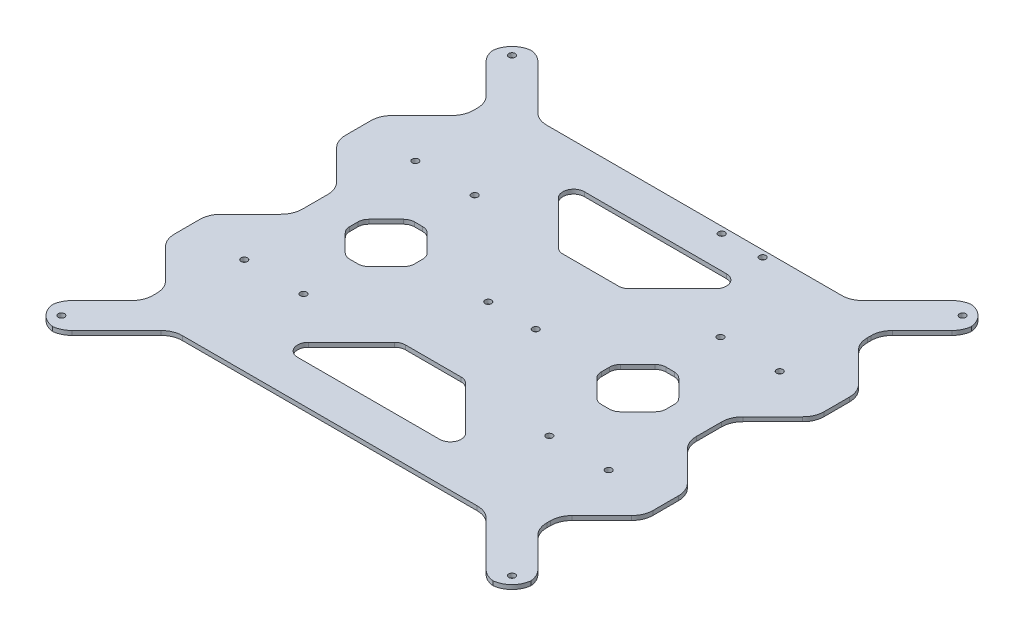
from build123d import *

# Parameters (mm, degrees)
SKETCH1_R           = 1.5
BOSS_EXTRUDE1_DEPTH = 2


with BuildPart() as part:
    # Sketch1 → Boss-Extrude1 (new body)
    with BuildSketch(Plane(origin=(0, 0, 0), x_dir=(1, 0, 0), z_dir=(0, 1, 0))):
        with BuildLine():
            ThreePointArc((-102.071067812, 110.942475232), (-108.071067812, 108.071067812), (-110.942475232, 102.071067812))
            ThreePointArc((-110.942475232, 102.071067812), (-110.02026395, 98.825326817), (-108.071067812, 96.071067812))
            Line((-108.071067812, 96.071067812), (-94.262265521, 82.262265521))
            ThreePointArc((-94.262265521, 82.262265521), (-92.094538008, 79.018032033), (-91.333333333, 75.19119771))
            Line((-91.333333333, 75.19119771), (-91.333333333, 73.475468957))
            ThreePointArc((-91.333333333, 73.475468957), (-92.094538008, 69.648634633), (-94.262265521, 66.404401145))
            Line((-94.262265521, 66.404401145), (-108.071067812, 52.595598855))
            ThreePointArc((-108.071067812, 52.595598855), (-110.238795325, 49.351365367), (-111, 45.524531043))
            Line((-111, 45.524531043), (-111, 33.80880229))
            ThreePointArc((-111, 33.80880229), (-110.238795325, 29.981967967), (-108.071067812, 26.737734479))
            Line((-108.071067812, 26.737734479), (-94.262265521, 12.928932188))
            ThreePointArc((-94.262265521, 12.928932188), (-92.094538008, 9.6846987), (-91.333333333, 5.857864376))
            Line((-91.333333333, 5.857864376), (-91.333333333, -5.857864376))
            ThreePointArc((-91.333333333, -5.857864376), (-92.094538008, -9.6846987), (-94.262265521, -12.928932188))
            Line((-94.262265521, -12.928932188), (-108.071067812, -26.737734479))
            ThreePointArc((-108.071067812, -26.737734479), (-110.238795325, -29.981967967), (-111, -33.80880229))
            Line((-111, -33.80880229), (-111, -45.524531043))
            ThreePointArc((-111, -45.524531043), (-110.238795325, -49.351365367), (-108.071067812, -52.595598855))
            Line((-108.071067812, -52.595598855), (-94.262265521, -66.404401145))
            ThreePointArc((-94.262265521, -66.404401145), (-92.094538008, -69.648634633), (-91.333333333, -73.475468957))
            Line((-91.333333333, -73.475468957), (-91.333333333, -75.19119771))
            ThreePointArc((-91.333333333, -75.19119771), (-92.094538008, -79.018032033), (-94.262265521, -82.262265521))
            Line((-94.262265521, -82.262265521), (-108.071067812, -96.071067812))
            ThreePointArc((-108.071067812, -96.071067812), (-110.02026395, -98.825326817), (-110.942475232, -102.071067812))
            ThreePointArc((-110.942475232, -102.071067812), (-108.071067812, -108.071067812), (-102.071067812, -110.942475232))
            ThreePointArc((-102.071067812, -110.942475232), (-98.825326817, -110.02026395), (-96.071067812, -108.071067812))
            Line((-96.071067812, -108.071067812), (-75.428932188, -87.428932188))
            ThreePointArc((-75.428932188, -87.428932188), (-72.1846987, -85.261204675), (-68.357864376, -84.5))
            Line((-68.357864376, -84.5), (68.357864376, -84.5))
            ThreePointArc((68.357864376, -84.5), (72.1846987, -85.261204675), (75.428932188, -87.428932188))
            Line((75.428932188, -87.428932188), (96.071067812, -108.071067812))
            ThreePointArc((96.071067812, -108.071067812), (98.825326817, -110.02026395), (102.071067812, -110.942475232))
            ThreePointArc((102.071067812, -110.942475232), (108.071067812, -108.071067812), (110.942475232, -102.071067812))
            ThreePointArc((110.942475232, -102.071067812), (110.02026395, -98.825326817), (108.071067812, -96.071067812))
            Line((108.071067812, -96.071067812), (94.262265521, -82.262265521))
            ThreePointArc((94.262265521, -82.262265521), (92.094538008, -79.018032033), (91.333333333, -75.19119771))
            Line((91.333333333, -75.19119771), (91.333333333, -73.475468957))
            ThreePointArc((91.333333333, -73.475468957), (92.094538008, -69.648634633), (94.262265521, -66.404401145))
            Line((94.262265521, -66.404401145), (108.071067812, -52.595598855))
            ThreePointArc((108.071067812, -52.595598855), (110.238795325, -49.351365367), (111, -45.524531043))
            Line((111, -45.524531043), (111, -33.80880229))
            ThreePointArc((111, -33.80880229), (110.238795325, -29.981967967), (108.071067812, -26.737734479))
            Line((108.071067812, -26.737734479), (94.262265521, -12.928932188))
            ThreePointArc((94.262265521, -12.928932188), (92.094538008, -9.6846987), (91.333333333, -5.857864376))
            Line((91.333333333, -5.857864376), (91.333333333, 5.857864376))
            ThreePointArc((91.333333333, 5.857864376), (92.094538008, 9.6846987), (94.262265521, 12.928932188))
            Line((94.262265521, 12.928932188), (108.071067812, 26.737734479))
            ThreePointArc((108.071067812, 26.737734479), (110.238795325, 29.981967967), (111, 33.80880229))
            Line((111, 33.80880229), (111, 45.524531043))
            ThreePointArc((111, 45.524531043), (110.238795325, 49.351365367), (108.071067812, 52.595598855))
            Line((108.071067812, 52.595598855), (94.262265521, 66.404401145))
            ThreePointArc((94.262265521, 66.404401145), (92.094538008, 69.648634633), (91.333333333, 73.475468957))
            Line((91.333333333, 73.475468957), (91.333333333, 75.19119771))
            ThreePointArc((91.333333333, 75.19119771), (92.094538008, 79.018032033), (94.262265521, 82.262265521))
            Line((94.262265521, 82.262265521), (108.071067812, 96.071067812))
            ThreePointArc((108.071067812, 96.071067812), (110.02026395, 98.825326817), (110.942475232, 102.071067812))
            ThreePointArc((110.942475232, 102.071067812), (108.071067812, 108.071067812), (102.071067812, 110.942475232))
            ThreePointArc((102.071067812, 110.942475232), (98.825326817, 110.02026395), (96.071067812, 108.071067812))
            Line((96.071067812, 108.071067812), (75.428932188, 87.428932188))
            ThreePointArc((75.428932188, 87.428932188), (72.1846987, 85.261204675), (68.357864376, 84.5))
            Line((68.357864376, 84.5), (-68.357864376, 84.5))
            ThreePointArc((-68.357864376, 84.5), (-72.1846987, 85.261204675), (-75.428932188, 87.428932188))
            Line((-75.428932188, 87.428932188), (-96.071067812, 108.071067812))
            ThreePointArc((-96.071067812, 108.071067812), (-98.825326817, 110.02026395), (-102.071067812, 110.942475232))
        make_face()
        with Locations(Location((-104.5, -104.5, 0), (0, 0, 270))):
            Circle(SKETCH1_R, mode=Mode.SUBTRACT)
        with Locations(Location((-84.5, -39.666666667, 0), (0, 0, 270))):
            Circle(SKETCH1_R, mode=Mode.SUBTRACT)
        with Locations(Location((-57, -39.666666667, 0), (0, 0, 270))):
            Circle(SKETCH1_R, mode=Mode.SUBTRACT)
        with BuildLine():
            ThreePointArc((-63.797799427, 13.535533906), (-62.175682683, 14.619397663), (-60.262265521, 15))
            Line((-60.262265521, 15), (-56.404401145, 15))
            ThreePointArc((-56.404401145, 15), (-54.490983983, 14.619397663), (-52.868867239, 13.535533906))
            Line((-52.868867239, 13.535533906), (-44.797799427, 5.464466094))
            ThreePointArc((-44.797799427, 5.464466094), (-43.713935671, 3.84234935), (-43.333333333, 1.928932188))
            Line((-43.333333333, 1.928932188), (-43.333333333, -1.928932188))
            ThreePointArc((-43.333333333, -1.928932188), (-43.713935671, -3.84234935), (-44.797799427, -5.464466094))
            Line((-44.797799427, -5.464466094), (-52.868867239, -13.535533906))
            ThreePointArc((-52.868867239, -13.535533906), (-54.490983983, -14.619397663), (-56.404401145, -15))
            Line((-56.404401145, -15), (-60.262265521, -15))
            ThreePointArc((-60.262265521, -15), (-62.175682683, -14.619397663), (-63.797799427, -13.535533906))
            Line((-63.797799427, -13.535533906), (-71.868867239, -5.464466094))
            ThreePointArc((-71.868867239, -5.464466094), (-72.952730996, -3.84234935), (-73.333333333, -1.928932188))
            Line((-73.333333333, -1.928932188), (-73.333333333, 1.928932188))
            ThreePointArc((-73.333333333, 1.928932188), (-72.952730996, 3.84234935), (-71.868867239, 5.464466094))
            Line((-71.868867239, 5.464466094), (-63.797799427, 13.535533906))
        make_face(mode=Mode.SUBTRACT)
        with BuildLine():
            Line((-12.928932188, -36.5), (12.928932188, -36.5))
            ThreePointArc((12.928932188, -36.5), (14.84234935, -36.880602337), (16.464466094, -37.964466094))
            Line((16.464466094, -37.964466094), (36.464466094, -57.964466094))
            ThreePointArc((36.464466094, -57.964466094), (37.548329851, -63.413417162), (32.928932188, -66.5))
            Line((32.928932188, -66.5), (-32.928932188, -66.5))
            ThreePointArc((-32.928932188, -66.5), (-37.548329851, -63.413417162), (-36.464466094, -57.964466094))
            Line((-36.464466094, -57.964466094), (-16.464466094, -37.964466094))
            ThreePointArc((-16.464466094, -37.964466094), (-14.84234935, -36.880602337), (-12.928932188, -36.5))
        make_face(mode=Mode.SUBTRACT)
        with Locations(Location((-11, 0, 0), (0, 0, 270))):
            Circle(SKETCH1_R, mode=Mode.SUBTRACT)
        with Locations(Location((104.5, -104.5, 0), (0, 0, 270))):
            Circle(SKETCH1_R, mode=Mode.SUBTRACT)
        with Locations(Location((11, 0, 0), (0, 0, 270))):
            Circle(SKETCH1_R, mode=Mode.SUBTRACT)
        with Locations(Location((57, -39.666666667, 0), (0, 0, 270))):
            Circle(SKETCH1_R, mode=Mode.SUBTRACT)
        with Locations(Location((84.5, -39.666666667, 0), (0, 0, 270))):
            Circle(SKETCH1_R, mode=Mode.SUBTRACT)
        with BuildLine():
            Line((73.333333333, 1.928932188), (73.333333333, -1.928932188))
            ThreePointArc((73.333333333, -1.928932188), (72.952730996, -3.84234935), (71.868867239, -5.464466094))
            Line((71.868867239, -5.464466094), (63.797799427, -13.535533906))
            ThreePointArc((63.797799427, -13.535533906), (62.175682683, -14.619397663), (60.262265521, -15))
            Line((60.262265521, -15), (56.404401145, -15))
            ThreePointArc((56.404401145, -15), (54.490983983, -14.619397663), (52.868867239, -13.535533906))
            Line((52.868867239, -13.535533906), (44.797799427, -5.464466094))
            ThreePointArc((44.797799427, -5.464466094), (43.713935671, -3.84234935), (43.333333333, -1.928932188))
            Line((43.333333333, -1.928932188), (43.333333333, 1.928932188))
            ThreePointArc((43.333333333, 1.928932188), (43.713935671, 3.84234935), (44.797799427, 5.464466094))
            Line((44.797799427, 5.464466094), (52.868867239, 13.535533906))
            ThreePointArc((52.868867239, 13.535533906), (54.490983983, 14.619397663), (56.404401145, 15))
            Line((56.404401145, 15), (60.262265521, 15))
            ThreePointArc((60.262265521, 15), (62.175682683, 14.619397663), (63.797799427, 13.535533906))
            Line((63.797799427, 13.535533906), (71.868867239, 5.464466094))
            ThreePointArc((71.868867239, 5.464466094), (72.952730996, 3.84234935), (73.333333333, 1.928932188))
        make_face(mode=Mode.SUBTRACT)
        with Locations(Location((-84.5, 39.666666667, 0), (0, 0, 270))):
            Circle(SKETCH1_R, mode=Mode.SUBTRACT)
        with Locations(Location((-57, 39.666666667, 0), (0, 0, 270))):
            Circle(SKETCH1_R, mode=Mode.SUBTRACT)
        with Locations(Location((-104.5, 104.5, 0), (0, 0, 270))):
            Circle(SKETCH1_R, mode=Mode.SUBTRACT)
        with BuildLine():
            ThreePointArc((-36.464466094, 57.964466094), (-37.548329851, 63.413417162), (-32.928932188, 66.5))
            Line((-32.928932188, 66.5), (32.928932188, 66.5))
            ThreePointArc((32.928932188, 66.5), (37.548329851, 63.413417162), (36.464466094, 57.964466094))
            Line((36.464466094, 57.964466094), (16.464466094, 37.964466094))
            ThreePointArc((16.464466094, 37.964466094), (14.84234935, 36.880602337), (12.928932188, 36.5))
            Line((12.928932188, 36.5), (-12.928932188, 36.5))
            ThreePointArc((-12.928932188, 36.5), (-14.84234935, 36.880602337), (-16.464466094, 37.964466094))
            Line((-16.464466094, 37.964466094), (-36.464466094, 57.964466094))
        make_face(mode=Mode.SUBTRACT)
        with Locations(Location((57, 39.666666667, 0), (0, 0, 270))):
            Circle(SKETCH1_R, mode=Mode.SUBTRACT)
        with Locations(Location((84.5, 39.666666667, 0), (0, 0, 270))):
            Circle(SKETCH1_R, mode=Mode.SUBTRACT)
        with Locations(Location((15.75, 81.5, 0), (0, 0, 270))):
            Circle(SKETCH1_R, mode=Mode.SUBTRACT)
        with Locations(Location((34.75, 81.5, 0), (0, 0, 270))):
            Circle(SKETCH1_R, mode=Mode.SUBTRACT)
        with Locations(Location((104.5, 104.5, 0), (0, 0, 270))):
            Circle(SKETCH1_R, mode=Mode.SUBTRACT)
    extrude(amount=BOSS_EXTRUDE1_DEPTH)


solid = part.part
